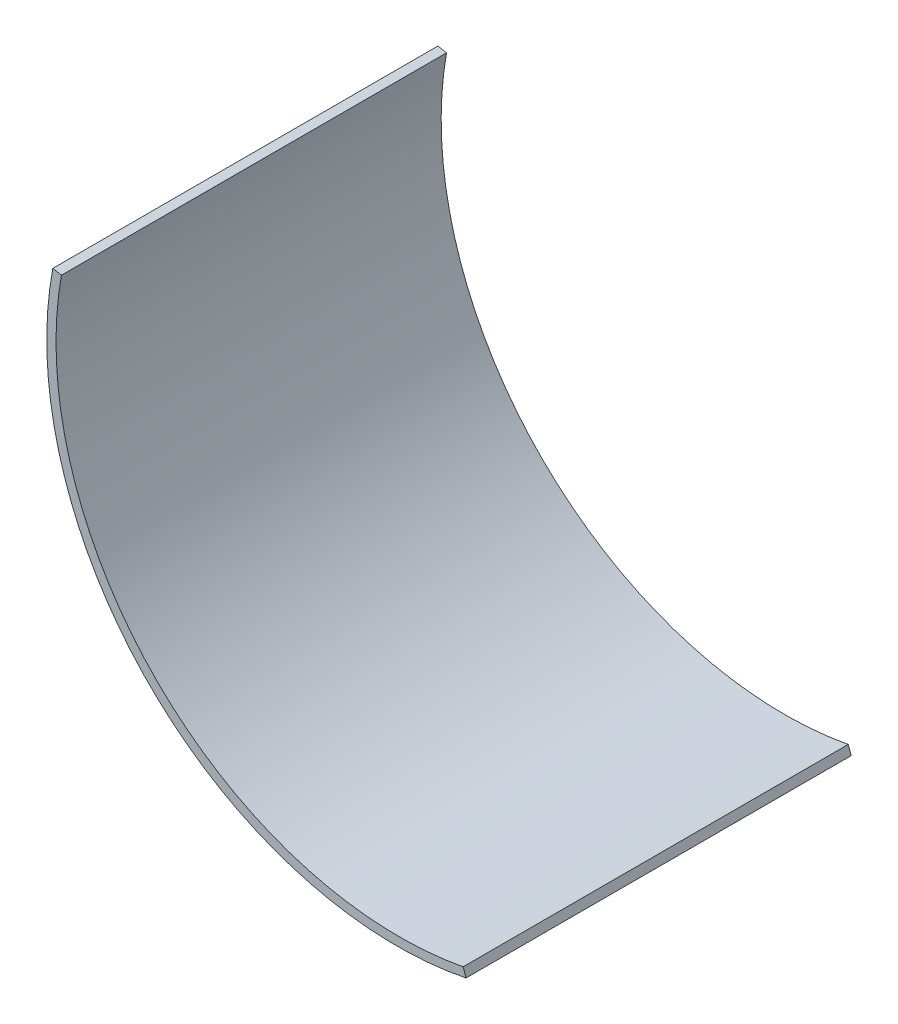
from build123d import *

# Parameters (mm, degrees)
BOSS_EXTRUDE1_DEPTH = 139.7


with BuildPart() as part:
    # Sketch1 → Boss-Extrude1 (new body)
    with BuildSketch(Plane.XY):
        with BuildLine():
            Line((-149.891869348, 147.971992557), (-146.771571106, 147.385167303))
            ThreePointArc((-146.771571106, 147.385167303), (-111.831521488, 36.924214704), (-1.056152055, 2.994189012))
            Line((-1.056152055, 2.994189012), (0, 0))
            ThreePointArc((0, 0), (-114.301826566, 34.119477597), (-149.891869348, 147.971992557))
        make_face()
    extrude(amount=BOSS_EXTRUDE1_DEPTH)


solid = part.part
